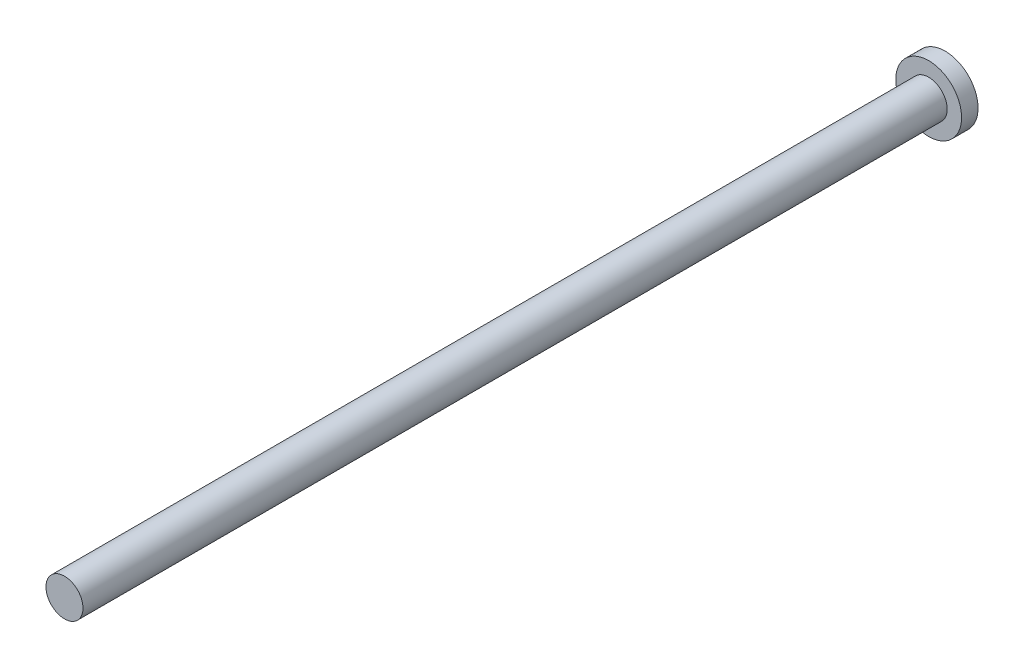
from build123d import *

# Parameters (mm, degrees)
SKETCH1_R           = 2.8575
BOSS_EXTRUDE1_DEPTH = 133.35
SKETCH2_R           = 5.08
BOSS_EXTRUDE2_DEPTH = 2.54


with BuildPart() as part:
    # Sketch1 → Boss-Extrude1 (new body)
    with BuildSketch(Plane.XY):
        Circle(SKETCH1_R)
    extrude(amount=BOSS_EXTRUDE1_DEPTH)

    # Sketch2 → Boss-Extrude2 (add)
    with BuildSketch(Plane(origin=(0, 0, 0), x_dir=(-1, 0, 0), z_dir=(0, 0, -1))):
        Circle(SKETCH2_R)
    extrude(amount=BOSS_EXTRUDE2_DEPTH)


solid = part.part
